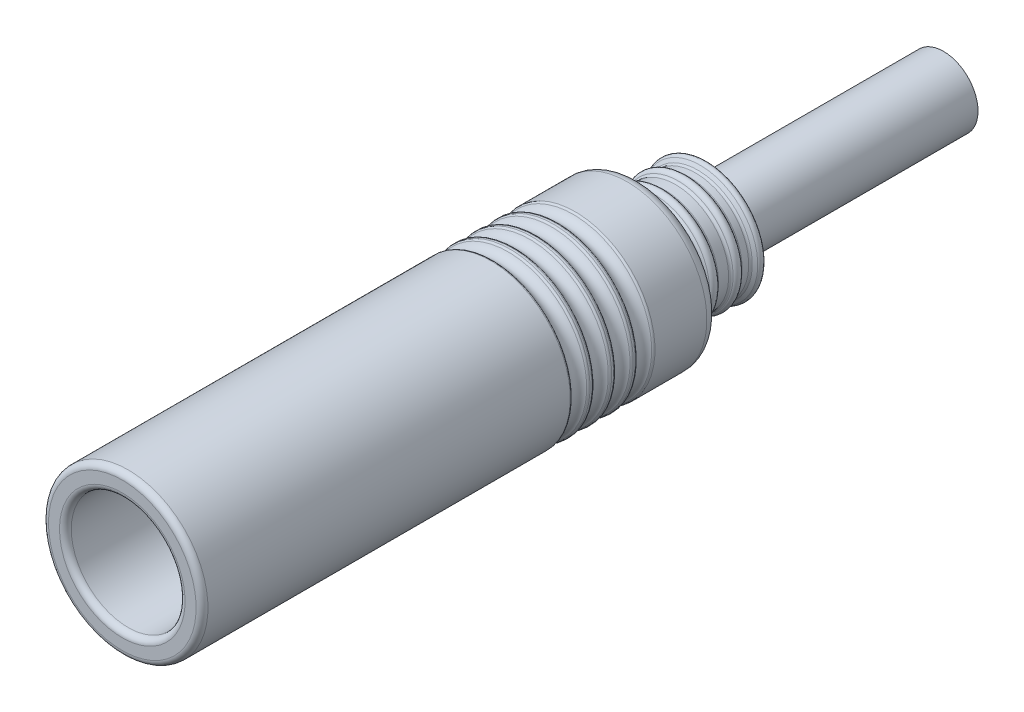
from build123d import *

# Parameters (mm, degrees)
SKETCH2_R           = 2.92
BOSS_EXTRUDE1_DEPTH = 20


with BuildPart() as part:
    # Sketch1 → Revolve1 (revolve)
    with BuildSketch(Plane(origin=(0, 0, 0), x_dir=(0, 0, -1), z_dir=(1, 0, 0)), mode=Mode.PRIVATE) as revolve1_sk:
        with BuildLine():
            Line((0, 6.25), (0, 5.315))
            ThreePointArc((0, 5.315), (0.146446609, 4.961446609), (0.5, 4.815))
            Line((0.5, 4.815), (8.37, 4.815))
            Line((8.37, 4.815), (8.37, 0))
            Line((8.37, 0), (49.5, 0))
            Line((49.5, 0), (49.5, 4.675))
            ThreePointArc((49.5, 4.675), (49.276177603, 4.983849628), (48.912996353, 4.867299477))
            Line((48.912996353, 4.867299477), (48.718334631, 4.602077325))
            ThreePointArc((48.718334631, 4.602077325), (48.629752054, 4.526974588), (48.516793364, 4.5))
            Line((48.516793364, 4.5), (47.96271987, 4.5))
            ThreePointArc((47.96271987, 4.5), (47.825789231, 4.540834993), (47.733591085, 4.65))
            ThreePointArc((47.733591085, 4.65), (47.389897908, 4.875), (47.046204731, 4.65))
            ThreePointArc((47.046204731, 4.65), (46.954006586, 4.540834993), (46.817075946, 4.5))
            Line((46.817075946, 4.5), (45.96271987, 4.5))
            ThreePointArc((45.96271987, 4.5), (45.825789231, 4.540834993), (45.733591085, 4.65))
            ThreePointArc((45.733591085, 4.65), (45.389897908, 4.875), (45.046204731, 4.65))
            ThreePointArc((45.046204731, 4.65), (44.954006586, 4.540834993), (44.817075946, 4.5))
            Line((44.817075946, 4.5), (44.767075946, 4.5))
            ThreePointArc((44.767075946, 4.5), (44.717853174, 4.504893658), (44.670557437, 4.519383051))
            Line((44.670557437, 4.519383051), (44.119531756, 4.75))
            ThreePointArc((44.119531756, 4.75), (43.9158616, 4.906892942), (43.817075946, 5.144249893))
            Line((43.817075946, 5.144249893), (43.717075946, 5.883968012))
            ThreePointArc((43.717075946, 5.883968012), (43.384129798, 6.502983403), (42.72609029, 6.75))
            Line((42.72609029, 6.75), (38.335296139, 6.75))
            ThreePointArc((38.335296139, 6.75), (38.23295786, 6.721833864), (38.15944432, 6.645268766))
            ThreePointArc((38.15944432, 6.645268766), (37.5, 6.252526641), (36.84055568, 6.645268766))
            ThreePointArc((36.84055568, 6.645268766), (36.76704214, 6.721833864), (36.664703861, 6.75))
            Line((36.664703861, 6.75), (36.501962805, 6.75))
            ThreePointArc((36.501962805, 6.75), (36.399624526, 6.721833864), (36.326110987, 6.645268766))
            ThreePointArc((36.326110987, 6.645268766), (35.666666667, 6.252526641), (35.007222347, 6.645268766))
            ThreePointArc((35.007222347, 6.645268766), (34.933708807, 6.721833864), (34.831370528, 6.75))
            Line((34.831370528, 6.75), (34.668629472, 6.75))
            ThreePointArc((34.668629472, 6.75), (34.566291193, 6.721833864), (34.492777653, 6.645268766))
            ThreePointArc((34.492777653, 6.645268766), (33.833333333, 6.252526641), (33.173889013, 6.645268766))
            ThreePointArc((33.173889013, 6.645268766), (33.100375474, 6.721833864), (32.998037195, 6.75))
            Line((32.998037195, 6.75), (32.835296139, 6.75))
            ThreePointArc((32.835296139, 6.75), (32.73295786, 6.721833864), (32.65944432, 6.645268766))
            ThreePointArc((32.65944432, 6.645268766), (32, 6.252526641), (31.34055568, 6.645268766))
            ThreePointArc((31.34055568, 6.645268766), (31.26704214, 6.721833864), (31.164703861, 6.75))
            Line((31.164703861, 6.75), (0.5, 6.75))
            ThreePointArc((0.5, 6.75), (0.146446609, 6.603553391), (0, 6.25))
        make_face()
    revolve(revolve1_sk.sketch.rotate(Axis((0, 0, -49.5), (0, 0, 1)), 90), axis=Axis((0, 0, -49.5), (0, 0, 1)))

    # Sketch2 → Boss-Extrude1 (add)
    with BuildSketch(Plane(origin=(0, 0, -49.5), x_dir=(-1, 0, 0), z_dir=(0, 0, -1))):
        with Locations(Location((0, 0, 0), (0, 0, 180))):
            Circle(SKETCH2_R)
    extrude(amount=BOSS_EXTRUDE1_DEPTH)


solid = part.part
